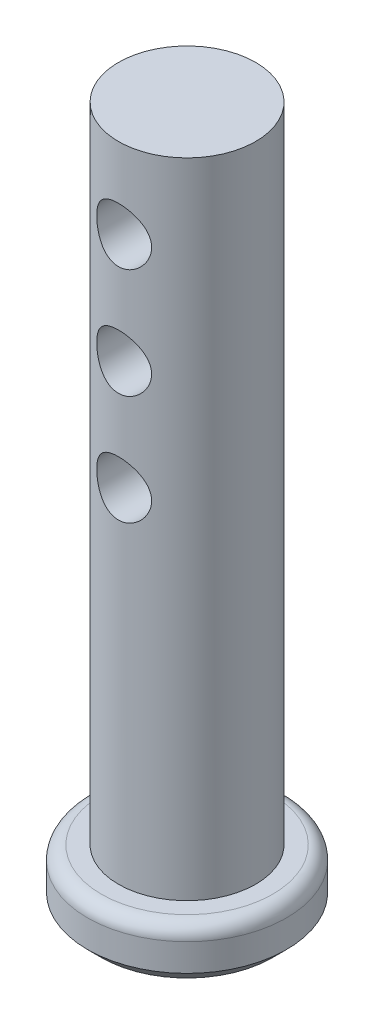
from build123d import *

# Parameters (mm, degrees)
SKETCH1_R               = 4.60375
BOSS_EXTRUDE1_DEPTH     = 2.54
SKETCH2_R               = 3.175
BOSS_EXTRUDE2_DEPTH     = 45.72
CUT_EXTRUDE1_DEPTH      = 49.697193226
CUT_EXTRUDE1_DEPTH_BACK = 49.697193226
SKETCH3_R               = 1.27
FILLET1_R               = 0.635
CHAMFER1_SIZE           = 0.635
CUT_EXTRUDE2_DEPTH      = 49.697193335
CUT_EXTRUDE2_DEPTH_BACK = 49.697193335
SKETCH4_W               = 16.845680721
SKETCH4_H               = 19.604839444


with BuildPart() as part:
    # Sketch1 → Boss-Extrude1 (new body)
    with BuildSketch(Plane(origin=(0, 0, 0), x_dir=(1, 0, 0), z_dir=(0, 1, 0))):
        with Locations(Location((0, 0, 0), (0, 0, 270))):
            Circle(SKETCH1_R)
    extrude(amount=BOSS_EXTRUDE1_DEPTH)

    # Sketch2 → Boss-Extrude2 (add)
    with BuildSketch(Plane(origin=(0, 2.54, 0), x_dir=(1, 0, 0), z_dir=(0, 1, 0))):
        with Locations(Location((0, 0, 0), (0, 0, 270))):
            Circle(SKETCH2_R)
    extrude(amount=BOSS_EXTRUDE2_DEPTH)

    # Sketch3 → Cut-Extrude1 (cut, two sides: drawn at the far end of the back side and taken through both)
    with BuildSketch(Plane.XY.offset(-CUT_EXTRUDE1_DEPTH_BACK)):
        with Locations(Location((0, 18.415, 0), (0, 0, 89.999999999))):
            Circle(SKETCH3_R)
        with Locations(Location((0, 23.495, 0), (0, 0, 89.999999999))):
            Circle(SKETCH3_R)
        with Locations(Location((0, 28.575, 0), (0, 0, 89.999999999))):
            Circle(SKETCH3_R)
        with Locations(Location((0, 33.655, 0), (0, 0, 89.999999999))):
            Circle(SKETCH3_R)
        with Locations(Location((0, 38.735, 0), (0, 0, 89.999999999))):
            Circle(SKETCH3_R)
        with Locations(Location((0, 43.815, 0), (0, 0, 89.999999999))):
            Circle(SKETCH3_R)
    extrude(amount=CUT_EXTRUDE1_DEPTH + CUT_EXTRUDE1_DEPTH_BACK, mode=Mode.SUBTRACT)

    # Fillet1
    fillet1_edges = [part.edges().sort_by_distance(p)[0] for p in [
        (0, 2.54, -4.60375),
    ]]
    fillet(fillet1_edges, radius=FILLET1_R)

    # Chamfer1
    chamfer1_edges = [part.edges().sort_by_distance(p)[0] for p in [
        (0, 0, -4.60375),
    ]]
    chamfer(chamfer1_edges, length=CHAMFER1_SIZE)

    # Sketch4 → Cut-Extrude2 (cut, two sides: drawn at the far end of the back side and taken through both)
    with BuildSketch(Plane(origin=(0, 0, 0), x_dir=(0, 0, -1), z_dir=(1, 0, 0)).offset(-CUT_EXTRUDE2_DEPTH_BACK)):
        with Locations((1.010740844, 42.122953468)):
            Rectangle(SKETCH4_W, SKETCH4_H)
    extrude(amount=CUT_EXTRUDE2_DEPTH + CUT_EXTRUDE2_DEPTH_BACK, mode=Mode.SUBTRACT)


solid = part.part
